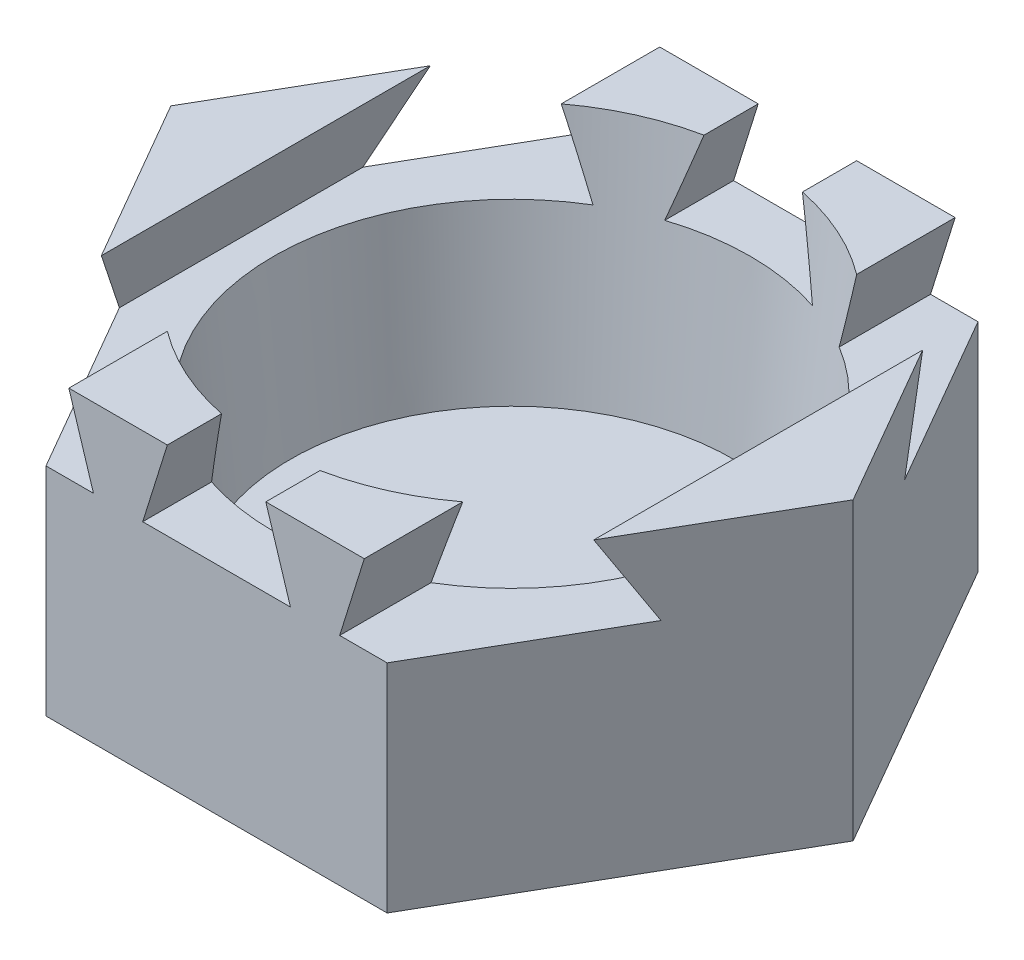
from build123d import *

# Parameters (mm, degrees)
EXTRUDE_1_DEPTH               = 30
CUT_EXTRUDE_1_DEPTH           = 55.772255751
PATTERN_LINEAR_1_COUNT        = 2
PATTERN_LINEAR_1_PITCH        = 20
PATTERN_LINEAR_2_COPY_1_DEPTH = 55.772255751
PATTERN_LINEAR_2_COPY_2_DEPTH = 55.772255751


with BuildPart() as part:
    # 草圖1 → 填料-伸長1 (new body)
    with BuildSketch(Plane(origin=(0, 0, 0), x_dir=(1, 0, 0), z_dir=(0, 1, 0))):
        Polygon((17.320508076, -30), (34.641016151, 0), (17.320508076, 30), (-17.320508076, 30), (-34.641016151, 0), (-17.320508076, -30), align=None)
    extrude(amount=EXTRUDE_1_DEPTH)

    # 草圖2 → 除料-旋轉1 (revolve, cut)
    with BuildSketch(Plane.XY):
        Polygon((0, 30), (25, 30), (22.5, 5), (0, 5), align=None)
    revolve(axis=Axis((0, 5, 0), (0, 1, 0)), mode=Mode.SUBTRACT)

    # 草圖3 → 除料-伸長1 (cut, symmetric)
    with BuildSketch(Plane.XY):
        Polygon((-5, 30), (-7.5, 22), (7.5, 22), (5, 30), align=None)
    cut_extrude_1 = extrude(amount=CUT_EXTRUDE_1_DEPTH, both=True, mode=Mode.SUBTRACT)

    # 直線複製排列1: 除料-伸長1 ×2
    with Locations(*[(-i * PATTERN_LINEAR_1_PITCH, 0, 0) for i in range(1, PATTERN_LINEAR_1_COUNT)]):
        add(cut_extrude_1, mode=Mode.SUBTRACT)

    # 直線複製排列2 copy 1 sketch → 直線複製排列2 copy 1 (cut, symmetric)
    with BuildSketch(Plane.XY):
        Polygon((-5, 30), (-7.5, 22), (7.5, 22), (5, 30), align=None)
    extrude(amount=PATTERN_LINEAR_2_COPY_1_DEPTH, both=True, mode=Mode.SUBTRACT)

    # 直線複製排列2 copy 2 sketch → 直線複製排列2 copy 2 (cut, symmetric)
    with BuildSketch(Plane(origin=(20, 0, 0), x_dir=(1, 0, 0), z_dir=(0, 0, 1))):
        Polygon((-5, 30), (-7.5, 22), (7.5, 22), (5, 30), align=None)
    extrude(amount=PATTERN_LINEAR_2_COPY_2_DEPTH, both=True, mode=Mode.SUBTRACT)


solid = part.part
